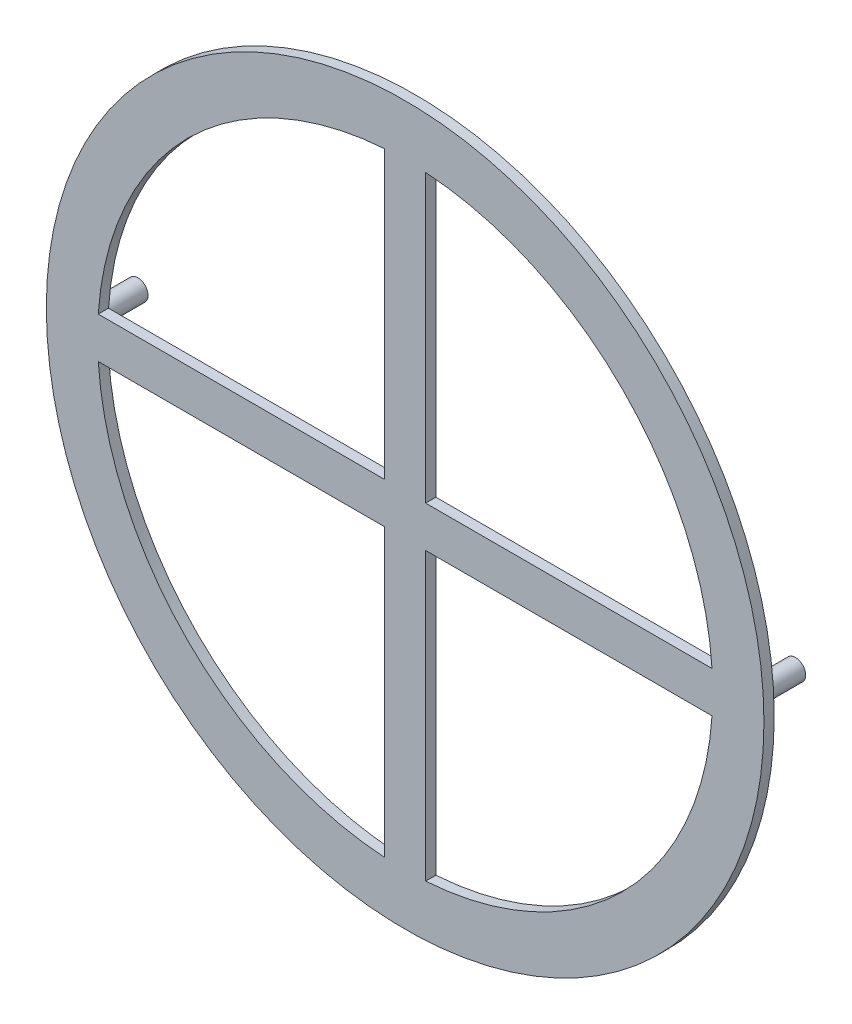
from build123d import *

# Parameters (mm, degrees)
SKETCH1_W           = 5
SKETCH1_H           = 1
BOSS_EXTRUDE1_DEPTH = 1
SKETCH3_R           = 1
BOSS_EXTRUDE2_DEPTH = 5


with BuildPart() as part:
    # Sketch1 → Revolve1 (revolve)
    with BuildSketch(Plane(origin=(0, 0, 0), x_dir=(1, 0, 0), z_dir=(0, 1, 0))):
        with Locations((32.5, 0.5)):
            Rectangle(SKETCH1_W, SKETCH1_H)
    revolve(axis=Axis((0, 0, 0), (0, 0, -1)))

    # Sketch2 → Boss-Extrude1 (add)
    with BuildSketch(Plane(origin=(0, 0, -1), x_dir=(-1, 0, 0), z_dir=(0, 0, -1))):
        Polygon((-2, -30.927225956), (2, -30.927225956), (2, -2), (31.252775703, -2), (31.252775703, 2), (2, 2), (2, 30.927225956), (-2, 30.927225956), (-2, 2), (-31.252775703, 2), (-31.252775703, -2), (-2, -2), align=None)
    extrude(amount=-BOSS_EXTRUDE1_DEPTH)

    # Sketch3 → Boss-Extrude2 (add)
    with BuildSketch(Plane(origin=(0, 0, -1), x_dir=(-1, 0, 0), z_dir=(0, 0, -1))):
        with Locations((-32.071898489, 0)):
            Circle(SKETCH3_R)
        with Locations(Location((32.071898489, 0, 0), (0, 0, 180))):
            Circle(SKETCH3_R)
    extrude(amount=BOSS_EXTRUDE2_DEPTH)


solid = part.part
